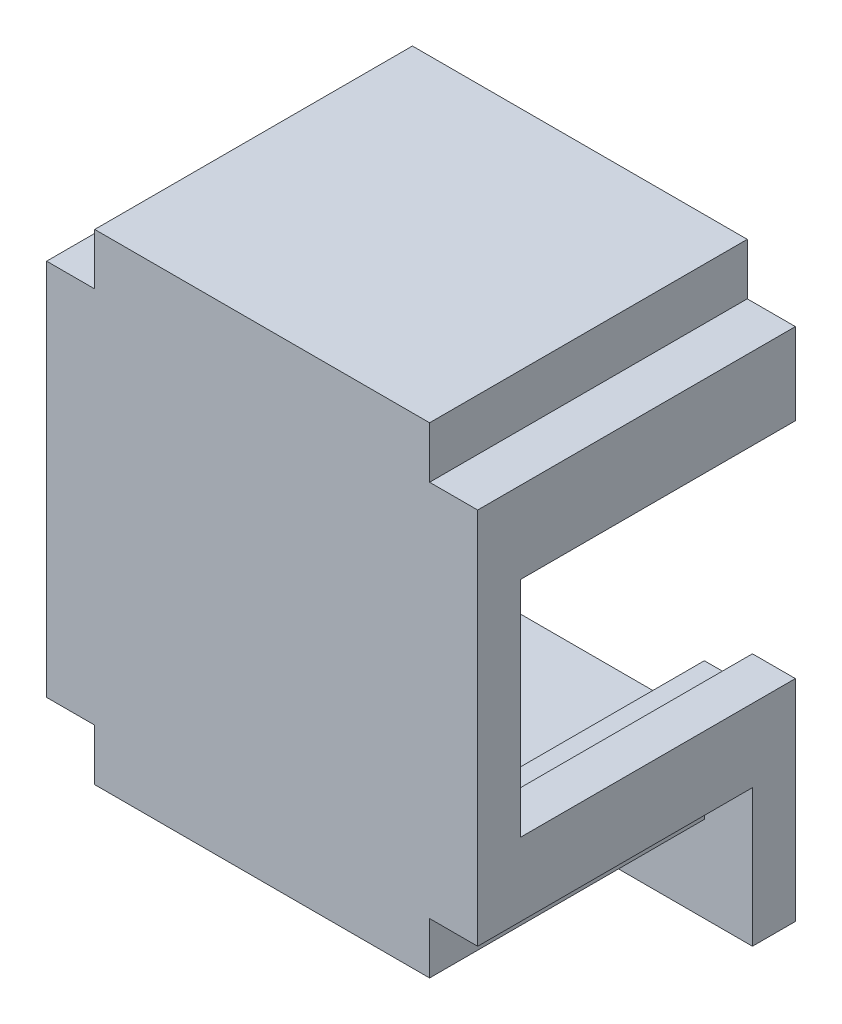
from build123d import *

# Parameters (mm, degrees)
BOSS_EXTRUDE1_DEPTH   = 32
BOSS_EXTRUDE1_2_DEPTH = 32
BOSS_EXTRUDE2_DEPTH   = 5
BOSS_EXTRUDE3_DEPTH   = 5


with BuildPart() as part:
    # Sketch1 → Boss-Extrude1 (new body)
    with BuildSketch(Plane(origin=(0, 0, 0), x_dir=(-1, 0, 0), z_dir=(0, 0, 1))):
        Polygon((-29.846050857, 76.265916966), (-29.846050857, 79.765916966), (-24.246050857, 79.765916966), (-24.246050857, 85.765916966), (4.753949143, 85.765916966), (4.753949143, 79.765916966), (10.353949143, 79.765916966), (10.353949143, 76.265916966), (15.353949143, 76.265916966), (15.353949143, 84.765916966), (9.753949143, 84.765916966), (9.753949143, 90.765916966), (-29.246050857, 90.765916966), (-29.246050857, 84.765916966), (-34.846050857, 84.765916966), (-34.846050857, 76.265916966), align=None)
    extrude(amount=BOSS_EXTRUDE1_DEPTH)



with BuildPart() as body_2:
    # Sketch1 → Boss-Extrude1 2 (new body)
    with BuildSketch(Plane(origin=(0, 0, 0), x_dir=(-1, 0, 0), z_dir=(0, 0, 1))):
        Polygon((-29.846050857, 50.265916966), (-29.846050857, 45.765916966), (-24.246050857, 45.765916966), (-24.246050857, 39.765916966), (4.753949143, 39.765916966), (4.753949143, 45.765916966), (10.353949143, 45.765916966), (10.353949143, 50.265916966), (15.353949143, 50.265916966), (15.353949143, 40.765916966), (9.753949143, 40.765916966), (9.753949143, 34.765916966), (-29.246050857, 34.765916966), (-29.246050857, 40.765916966), (-34.846050857, 40.765916966), (-34.846050857, 50.265916966), align=None)
    extrude(amount=BOSS_EXTRUDE1_2_DEPTH)


with BuildPart() as part_1:
    add(part.part)

    add(body_2.part)  # Boss-Extrude2 merges body 2
    # Sketch2 → Boss-Extrude2 (add)
    with BuildSketch(Plane.XY.offset(32)):
        Polygon((-9.753949143, -34.765916966), (-9.753949143, -40.765916966), (-15.353949143, -40.765916966), (-15.353949143, -84.765916966), (-9.753949143, -84.765916966), (-9.753949143, -90.765916966), (29.246050857, -90.765916966), (29.246050857, -84.765916966), (34.846050857, -84.765916966), (34.846050857, -40.765916966), (29.246050857, -40.765916966), (29.246050857, -34.765916966), align=None)
    extrude(amount=BOSS_EXTRUDE2_DEPTH)

    # Sketch4 → Boss-Extrude3 (add)
    with BuildSketch(Plane(origin=(0, 0, 0), x_dir=(-1, 0, 0), z_dir=(0, 0, -1))):
        Polygon((-34.846050857, -84.765916966), (-34.846050857, -100.765916966), (15.353949143, -100.765916966), (15.353949143, -84.765916966), (9.753949143, -84.765916966), (9.753949143, -90.765916966), (-29.246050857, -90.765916966), (-29.246050857, -84.765916966), align=None)
    extrude(amount=-BOSS_EXTRUDE3_DEPTH)


solid = part_1.part
